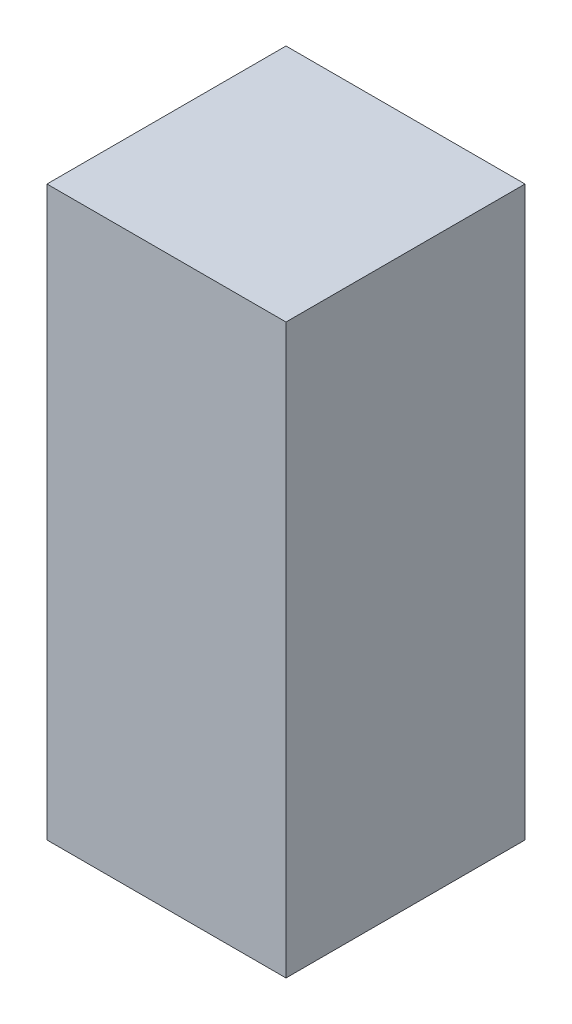
from build123d import *

# Parameters (mm, degrees)
SKETCH1_W           = 6
SKETCH1_H           = 6
BOSS_EXTRUDE1_DEPTH = 14.26


with BuildPart() as part:
    # Sketch1 → Boss-Extrude1 (new body)
    with BuildSketch(Plane(origin=(0, 0, 0), x_dir=(1, 0, 0), z_dir=(0, 1, 0))):
        Rectangle(SKETCH1_W, SKETCH1_H)
    extrude(amount=BOSS_EXTRUDE1_DEPTH)


solid = part.part
